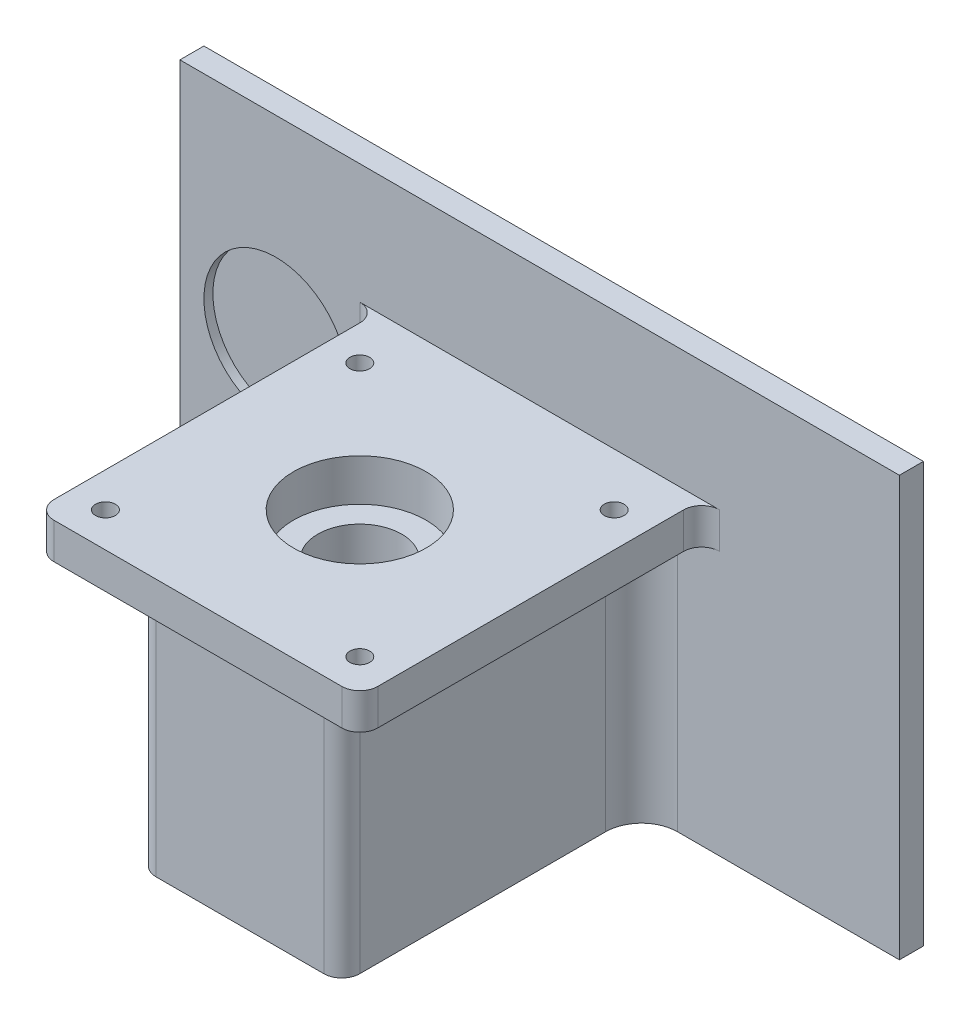
from build123d import *

# Parameters (mm, degrees)
SKETCH1_W           = 70
SKETCH1_H           = 120
BOSS_EXTRUDE1_DEPTH = 4
SKETCH2_W           = 34
SKETCH2_H           = 50
BOSS_EXTRUDE2_DEPTH = 50
SKETCH3_R           = 11.1
CUT_EXTRUDE1_DEPTH  = 7
SKETCH5_R           = 7
CUT_EXTRUDE3_DEPTH  = 103.396288995
SKETCH6_R           = 11.05
CUT_EXTRUDE4_DEPTH  = 7
SKETCH7_R           = 12
CUT_EXTRUDE5_DEPTH  = 1.5
SKETCH8_R           = 1.65
BOSS_EXTRUDE3_DEPTH = 6
FILLET1_R           = 3
FILLET2_R           = 6


with BuildPart() as part:
    # Sketch1 → Boss-Extrude1 (new body)
    with BuildSketch(Plane(origin=(0, 0, 0), x_dir=(0, 1, 0), z_dir=(0, 0, 1))):
        Rectangle(SKETCH1_W, SKETCH1_H)
    extrude(amount=BOSS_EXTRUDE1_DEPTH)

    # Sketch2 → Boss-Extrude2 (add)
    with BuildSketch(Plane.XY.offset(4)):
        with Locations((0, -10)):
            Rectangle(SKETCH2_W, SKETCH2_H)
    extrude(amount=BOSS_EXTRUDE2_DEPTH)

    # Sketch3 → Cut-Extrude1 (cut)
    with BuildSketch(Plane.XZ.offset(35)):
        with Locations((0, 34)):
            Circle(SKETCH3_R)
    extrude(amount=-CUT_EXTRUDE1_DEPTH, mode=Mode.SUBTRACT)

    # Sketch5 → Cut-Extrude3 (cut, through all)
    with BuildSketch(Plane.XZ.offset(28)):
        with Locations((0, 34)):
            Circle(SKETCH5_R)
    extrude(amount=-CUT_EXTRUDE3_DEPTH, mode=Mode.SUBTRACT)

    # Sketch6 → Cut-Extrude4 (cut)
    with BuildSketch(Plane(origin=(0, 15, 0), x_dir=(-1, 0, 0), z_dir=(0, 1, 0))):
        with Locations((0, 34)):
            Circle(SKETCH6_R)
    extrude(amount=-CUT_EXTRUDE4_DEPTH, mode=Mode.SUBTRACT)

    # Sketch7 → Cut-Extrude5 (cut)
    with BuildSketch(Plane.XY.offset(4)):
        with Locations((-44, 2.5)):
            Circle(SKETCH7_R)
    extrude(amount=-CUT_EXTRUDE5_DEPTH, mode=Mode.SUBTRACT)

    # Sketch8 → Boss-Extrude3 (add)
    with BuildSketch(Plane(origin=(0, 15, 0), x_dir=(-1, 0, 0), z_dir=(0, 1, 0))):
        Polygon((-17, 4), (-27, 4), (-27, 61), (27, 61), (27, 4), (17, 4), (17, 54), (-17, 54), align=None)
        with Locations(Location((-21.213203436, 55.213203436, 0), (0, 0, 90))):
            Circle(SKETCH8_R, mode=Mode.SUBTRACT)
        with Locations(Location((21.213203436, 55.213203436, 0), (0, 0, 90))):
            Circle(SKETCH8_R, mode=Mode.SUBTRACT)
        with Locations(Location((-21.213203436, 12.786796564, 0), (0, 0, 90))):
            Circle(SKETCH8_R, mode=Mode.SUBTRACT)
        with Locations(Location((21.213203436, 12.786796564, 0), (0, 0, 90))):
            Circle(SKETCH8_R, mode=Mode.SUBTRACT)
    extrude(amount=-BOSS_EXTRUDE3_DEPTH)

    # Fillet1
    fillet1_edges = [part.edges().sort_by_distance(p)[0] for p in [
        (17, -13, 54),
        (-17, -13, 54),
        (27, 12, 4),
        (27, 12, 61),
        (-27, 12, 61),
        (-27, 12, 4),
    ]]
    fillet(fillet1_edges, radius=FILLET1_R)

    # Fillet2
    fillet2_edges = [part.edges().sort_by_distance(p)[0] for p in [
        (17, -13, 4),
        (-17, -13, 4),
    ]]
    fillet(fillet2_edges, radius=FILLET2_R)


solid = part.part
